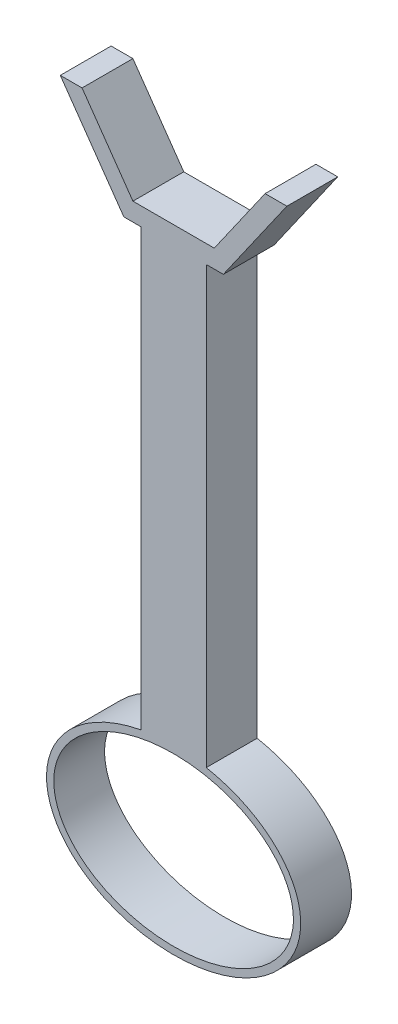
from build123d import *

# Parameters (mm, degrees)
ESTRUSIONE_ESTRUSIONE1_DEPTH = 7


with BuildPart() as part:
    # Schizzo1 → Estrusione-Estrusione1 (new body)
    with BuildSketch(Plane.XY):
        with BuildLine():
            Line((-0.123929519, 14.341623844), (-11.323929519, 14.341623844))
            Line((-11.323929519, 14.341623844), (-18.325552049, 24.344692471))
            Line((-18.325552049, 24.344692471), (-21.325552049, 24.344692471))
            Line((-21.325552049, 24.344692471), (-12.574060856, 11.841623844))
            Line((-12.574060856, 11.841623844), (-10.223929519, 11.841623844))
            Line((-10.223929519, 11.841623844), (-10.223929519, -48.158376156))
            add(Edge.make_bspline(
                [(-10.223929519, -48.158376156), (-23.223929519, -50.629217239), (-23.223929519, -60.238043674)],
                knots=[4.972453453, 4.972453453, 4.972453453, 6.283185307, 6.283185307, 6.283185307], degree=2, weights=[1, 0.792824967, 1]))
            add(Edge.make_bspline(
                [(-23.223929519, -60.238043674), (-23.223929519, -85.613275706), (4.941434985, -70.148355764), (33.106799489, -54.683435821), (-1.223929519, -48.158376156)],
                knots=[0, 0, 0, 2.226162254, 2.226162254, 4.452324508, 4.452324508, 4.452324508], degree=2, weights=[1, 0.441899649, 1, 0.441899649, 1]))
            Line((-1.223929519, -48.158376156), (-1.223929519, 11.841623844))
            Line((-1.223929519, 11.841623844), (1.126201818, 11.841623844))
            Line((1.126201818, 11.841623844), (9.877693011, 24.344692471))
            Line((9.877693011, 24.344692471), (6.877693011, 24.344692471))
            Line((6.877693011, 24.344692471), (-0.123929519, 14.341623844))
        make_face()
        with BuildLine():
            add(Edge.make_bspline(
                [(10.776070481, -60.238043674), (10.776070481, -40.319459387), (-13.973929519, -50.27875153), (-38.723929519, -60.238043674), (-13.973929519, -70.197335817), (10.776070481, -80.156627961), (10.776070481, -60.238043674)],
                knots=[0, 0, 0, 2.094395102, 2.094395102, 4.188790205, 4.188790205, 6.283185307, 6.283185307, 6.283185307], degree=2, weights=[1, 0.5, 1, 0.5, 1, 0.5, 1]))
        make_face(mode=Mode.SUBTRACT)
    extrude(amount=ESTRUSIONE_ESTRUSIONE1_DEPTH)


solid = part.part
